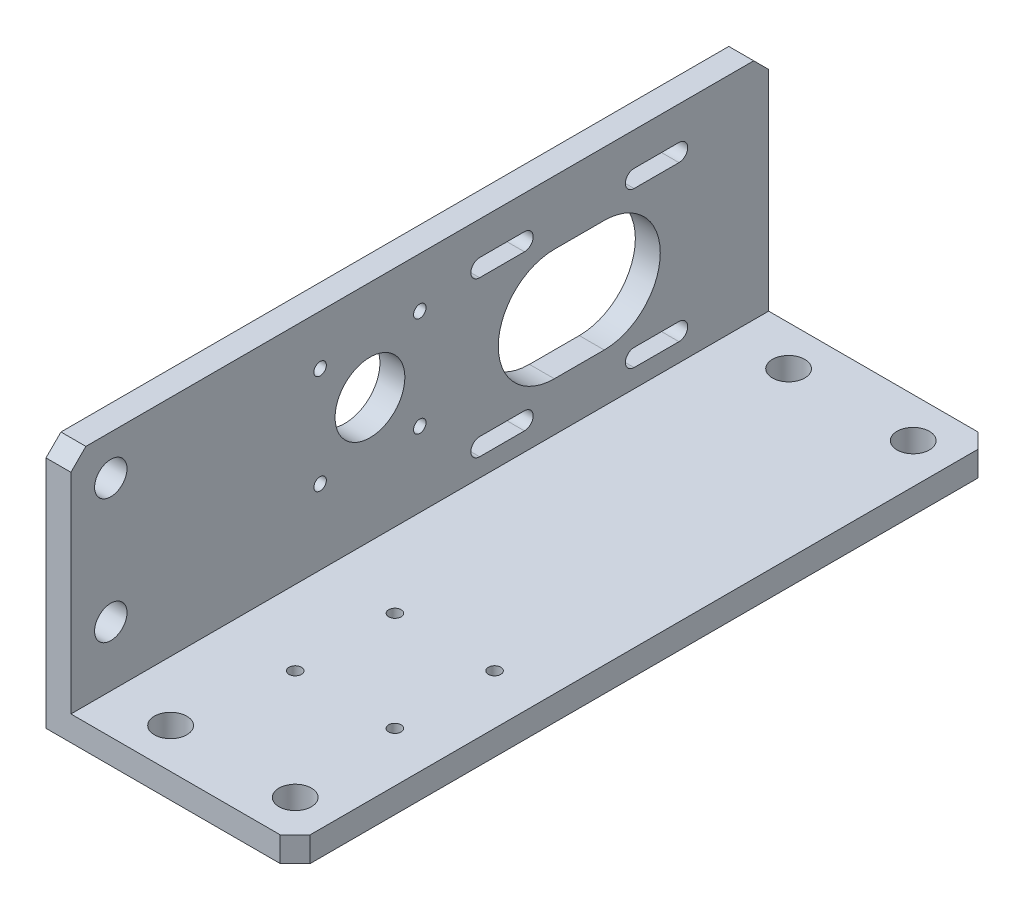
from build123d import *

# Parameters (mm, degrees)
ESTRUSIONE_ESTRUSIONE1_DEPTH = 140
FORO_6_5_6_5_1_D             = 6.5
FORO_6_5_6_5_2_D             = 6.5
FORO_6_5_6_5_2_DEPTH         = 5
FORO_6_5_6_5_2_TIP           = 1.952797012
TAGLIO_ESTRUSIONE3_REACH     = 158.844
SCHIZZO10_R                  = 7
TAGLIO_ESTRUSIONE6_REACH     = 158.844
SMUSSO1_SIZE                 = 3
M3_TAPPED_HOLE1_D            = 2.5
M3_TAPPED_HOLE2_D            = 2.5


with BuildPart() as part:
    # Schizzo1 → Estrusione-Estrusione1 (new body)
    with BuildSketch(Plane.XY):
        Polygon((0, 0), (0, 50), (5, 50), (5, 5), (50, 5), (50, 0), align=None)
    extrude(amount=ESTRUSIONE_ESTRUSIONE1_DEPTH)

    # Foro Ø6.5 (6.5)-1 (through all)
    with Locations(Plane(origin=(0, 0, 0), x_dir=(-1, 0, 0), z_dir=(0, -1, 0))):
        with Locations((-17, -132), (-42, -132)):
            foro_6_5_6_5_1 = Hole(FORO_6_5_6_5_1_D / 2)

    # Foro Ø6.5 (6.5)-2
    with Locations(Plane.ZY):
        with Locations((132, 42), (132, 17)):
            Hole(FORO_6_5_6_5_2_D / 2, depth=FORO_6_5_6_5_2_DEPTH)
            with Locations((0, 0, -(FORO_6_5_6_5_2_DEPTH + FORO_6_5_6_5_2_TIP / 2))):  # 118° drill point
                Cone(0, FORO_6_5_6_5_2_D / 2, FORO_6_5_6_5_2_TIP, mode=Mode.SUBTRACT)

    # Specchia1: Foro Ø6.5 (6.5)-1 across plane
    add(foro_6_5_6_5_1.mirror(Plane.XY.offset(70)), mode=Mode.SUBTRACT)

    # Schizzo10 → Taglio-Estrusione3 (cut, up to next)
    with BuildSketch(Plane.ZY, mode=Mode.PRIVATE) as taglio_estrusione3_sk1:
        with Locations((80, 30)):
            Circle(SCHIZZO10_R)
    taglio_estrusione3_tool1 = extrude(taglio_estrusione3_sk1.sketch, amount=-TAGLIO_ESTRUSIONE3_REACH, mode=Mode.PRIVATE) & part.part
    add(taglio_estrusione3_tool1.solids().sort_by_distance((0, 30, 80))[0], mode=Mode.SUBTRACT)

    # Schizzo13 → Taglio-Estrusione6 (cut, up to next)
    with BuildSketch(Plane.ZY, mode=Mode.PRIVATE) as taglio_estrusione6_sk1:
        with BuildLine():
            Line((18, 43.306349186), (27, 43.306349186))
            ThreePointArc((27, 43.306349186), (28.75, 41.556349186), (27, 39.806349186))
            Line((27, 39.806349186), (18, 39.806349186))
            ThreePointArc((18, 39.806349186), (16.25, 41.556349186), (18, 43.306349186))
        make_face()
    taglio_estrusione6_tool1 = extrude(taglio_estrusione6_sk1.sketch, amount=-TAGLIO_ESTRUSIONE6_REACH, mode=Mode.PRIVATE) & part.part
    # Schizzo13 → Taglio-Estrusione6 (cut, up to next)
    with BuildSketch(Plane.ZY, mode=Mode.PRIVATE) as taglio_estrusione6_sk2:
        with BuildLine():
            Line((18, 8.693650814), (27, 8.693650814))
            ThreePointArc((27, 8.693650814), (28.75, 10.443650814), (27, 12.193650814))
            Line((27, 12.193650814), (18, 12.193650814))
            ThreePointArc((18, 12.193650814), (16.25, 10.443650814), (18, 8.693650814))
        make_face()
    taglio_estrusione6_tool2 = extrude(taglio_estrusione6_sk2.sketch, amount=-TAGLIO_ESTRUSIONE6_REACH, mode=Mode.PRIVATE) & part.part
    # Schizzo13 → Taglio-Estrusione6 (cut, up to next)
    with BuildSketch(Plane.ZY, mode=Mode.PRIVATE) as taglio_estrusione6_sk3:
        with BuildLine():
            Line((58, 43.306349186), (49, 43.306349186))
            ThreePointArc((49, 43.306349186), (47.25, 41.556349186), (49, 39.806349186))
            Line((49, 39.806349186), (58, 39.806349186))
            ThreePointArc((58, 39.806349186), (59.75, 41.556349186), (58, 43.306349186))
        make_face()
    taglio_estrusione6_tool3 = extrude(taglio_estrusione6_sk3.sketch, amount=-TAGLIO_ESTRUSIONE6_REACH, mode=Mode.PRIVATE) & part.part
    # Schizzo13 → Taglio-Estrusione6 (cut, up to next)
    with BuildSketch(Plane.ZY, mode=Mode.PRIVATE) as taglio_estrusione6_sk4:
        with BuildLine():
            Line((58, 8.693650814), (49, 8.693650814))
            ThreePointArc((49, 8.693650814), (47.25, 10.443650814), (49, 12.193650814))
            Line((49, 12.193650814), (58, 12.193650814))
            ThreePointArc((58, 12.193650814), (59.75, 10.443650814), (58, 8.693650814))
        make_face()
    taglio_estrusione6_tool4 = extrude(taglio_estrusione6_sk4.sketch, amount=-TAGLIO_ESTRUSIONE6_REACH, mode=Mode.PRIVATE) & part.part
    # Schizzo13 → Taglio-Estrusione6 (cut, up to next)
    with BuildSketch(Plane.ZY, mode=Mode.PRIVATE) as taglio_estrusione6_sk5:
        with BuildLine():
            Line((43, 14.75), (33, 14.75))
            ThreePointArc((33, 14.75), (21.75, 26), (33, 37.25))
            Line((33, 37.25), (43, 37.25))
            ThreePointArc((43, 37.25), (54.25, 26), (43, 14.75))
        make_face()
    taglio_estrusione6_tool5 = extrude(taglio_estrusione6_sk5.sketch, amount=-TAGLIO_ESTRUSIONE6_REACH, mode=Mode.PRIVATE) & part.part
    add(taglio_estrusione6_tool1.solids().sort_by_distance((0, 41.556349, 22.5))[0], mode=Mode.SUBTRACT)
    add(taglio_estrusione6_tool2.solids().sort_by_distance((0, 10.443651, 22.5))[0], mode=Mode.SUBTRACT)
    add(taglio_estrusione6_tool3.solids().sort_by_distance((0, 41.556349, 53.5))[0], mode=Mode.SUBTRACT)
    add(taglio_estrusione6_tool4.solids().sort_by_distance((0, 10.443651, 53.5))[0], mode=Mode.SUBTRACT)
    add(taglio_estrusione6_tool5.solids().sort_by_distance((0, 26, 38))[0], mode=Mode.SUBTRACT)

    # Smusso1
    smusso1_edges = [part.edges().sort_by_distance(p)[0] for p in [
        (2.5, 50, 140),
        (2.5, 50, 0),
        (50, 2.5, 140),
        (50, 2.5, 0),
    ]]
    chamfer(smusso1_edges, length=SMUSSO1_SIZE)

    # M3 Tapped Hole1 (through all)
    with Locations(Plane(origin=(0, 40, 70), x_dir=(0, 0, -1), z_dir=(-1, 0, 0))):
        with Locations((0, 0), (-20, 0), (-20, 20), (0, 20)):
            Hole(M3_TAPPED_HOLE1_D / 2)

    # M3 Tapped Hole2 (through all)
    with Locations(Plane(origin=(20, 0, 110), x_dir=(-1, 0, 0), z_dir=(0, -1, 0))):
        with Locations((0, 0), (-20, 0), (-20, 20), (0, 20)):
            Hole(M3_TAPPED_HOLE2_D / 2)


solid = part.part
